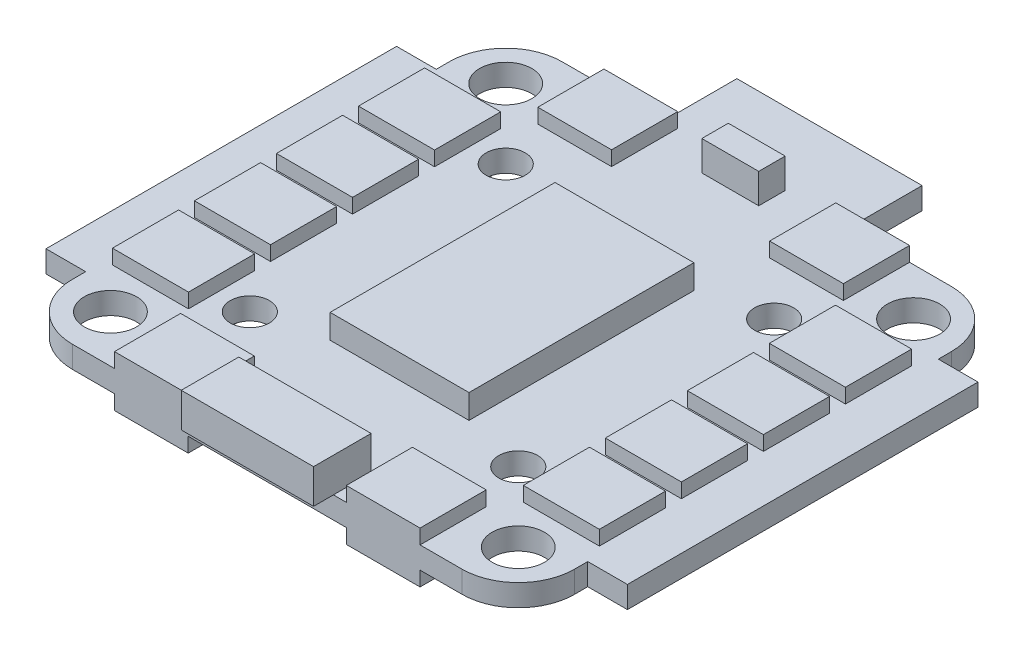
from build123d import *

# Parameters (mm, degrees)
SKETCH1_R                       = 1.975
PCB_DEPTH                       = 0.825
INNER_HOLES_DEPTH               = 48.873511726
INNER_HOLES_DEPTH_BACK          = 48.873511726
SKETCH7_R                       = 1.475
SKETCH8_W                       = 10
SKETCH8_H                       = 4.35
CONNECTOR_DEPTH                 = 2.6
SKETCH9_W                       = 4.3
SKETCH9_H                       = 2
TOP_COMPONENT_DEPTH             = 2.255
SKETCH10_W                      = 5.75
SKETCH10_H                      = 5
SIDE_COMPONENTS_DEPTH           = 1.1
SKETCH11_W                      = 10.5
SKETCH11_H                      = 17
CENTRAL_COMPONENTS_DEPTH        = 1.825
SKETCH12_W                      = 5.575
SKETCH12_H                      = 5
TOP_AND_BOTTOM_COMPONENTS_DEPTH = 1.105


with BuildPart() as part:
    # Sketch1 → PCB (new, symmetric)
    with BuildSketch(Plane(origin=(0, 0, 0), x_dir=(1, 0, 0), z_dir=(0, 1, 0))):
        with BuildLine():
            Line((-7, 42.5), (7, 42.5))
            Line((7, 42.5), (7, 37))
            Line((7, 37), (14.725, 37))
            ThreePointArc((14.725, 37), (17.73020382, 35.75520382), (18.975, 32.75))
            Line((18.975, 32.75), (18.975, 31.75))
            Line((18.975, 31.75), (21.975, 31.75))
            Line((21.975, 31.75), (21.975, 5.25))
            Line((21.975, 5.25), (18.975, 5.25))
            Line((18.975, 5.25), (18.975, 4.25))
            ThreePointArc((18.975, 4.25), (17.73020382, 1.24479618), (14.725, 0))
            Line((14.725, 0), (-14.725, 0))
            ThreePointArc((-14.725, 0), (-17.73020382, 1.24479618), (-18.975, 4.25))
            Line((-18.975, 4.25), (-18.975, 5.25))
            Line((-18.975, 5.25), (-21.975, 5.25))
            Line((-21.975, 5.25), (-21.975, 31.75))
            Line((-21.975, 31.75), (-18.975, 31.75))
            Line((-18.975, 31.75), (-18.975, 32.75))
            ThreePointArc((-18.975, 32.75), (-17.73020382, 35.75520382), (-14.725, 37))
            Line((-14.725, 37), (-7, 37))
            Line((-7, 37), (-7, 42.5))
        make_face()
        with Locations(Location((15.414429112, 33.439429112, 0), (0, 0, 270))):
            Circle(SKETCH1_R, mode=Mode.SUBTRACT)
        with Locations(Location((15.414429112, 3.560570888, 0), (0, 0, 90))):
            Circle(SKETCH1_R, mode=Mode.SUBTRACT)
        with Locations(Location((-15.414429112, 3.560570888, 0), (0, 0, 270))):
            Circle(SKETCH1_R, mode=Mode.SUBTRACT)
        with Locations(Location((-15.414429112, 33.439429112, 0), (0, 0, 90))):
            Circle(SKETCH1_R, mode=Mode.SUBTRACT)
    extrude(amount=PCB_DEPTH, both=True)

    # Sketch7 → inner holes (cut, two sides: drawn at the far end of the back side and taken through both)
    with BuildSketch(Plane(origin=(0, 0.825, 0), x_dir=(1, 0, 0), z_dir=(0, 1, 0)).offset(-INNER_HOLES_DEPTH_BACK)):
        with Locations(Location((10.146483592, 28.171483592, 0), (0, 0, 270))):
            Circle(SKETCH7_R)
        with Locations(Location((-10.146483592, 28.171483592, 0), (0, 0, 90))):
            Circle(SKETCH7_R)
        with Locations(Location((-10.146483592, 8.828516408, 0), (0, 0, 270))):
            Circle(SKETCH7_R)
        with Locations(Location((10.146483592, 8.828516408, 0), (0, 0, 90))):
            Circle(SKETCH7_R)
    extrude(amount=INNER_HOLES_DEPTH + INNER_HOLES_DEPTH_BACK, mode=Mode.SUBTRACT)

    # Sketch8 → Connector (add)
    with BuildSketch(Plane(origin=(0, 0.825, 0), x_dir=(1, 0, 0), z_dir=(0, 1, 0))):
        with Locations((0, 0.675)):
            Rectangle(SKETCH8_W, SKETCH8_H)
    extrude(amount=CONNECTOR_DEPTH)

    # Sketch9 → Top component (add)
    with BuildSketch(Plane(origin=(0, 0.825, 0), x_dir=(1, 0, 0), z_dir=(0, 1, 0))):
        with Locations((0, 36)):
            Rectangle(SKETCH9_W, SKETCH9_H)
    extrude(amount=TOP_COMPONENT_DEPTH)

    # Sketch10 → Side Components (add)
    with BuildSketch(Plane(origin=(0, 0.825, 0), x_dir=(1, 0, 0), z_dir=(0, 1, 0))):
        with Locations((15.53, 15.4)):
            Rectangle(SKETCH10_W, SKETCH10_H)
        with Locations((15.53, 9.2)):
            Rectangle(SKETCH10_W, SKETCH10_H)
        with Locations((15.53, 21.6)):
            Rectangle(SKETCH10_W, SKETCH10_H)
        with Locations((15.53, 27.8)):
            Rectangle(SKETCH10_W, SKETCH10_H)
        with Locations((-15.53, 9.2)):
            Rectangle(SKETCH10_W, SKETCH10_H)
        with Locations((-15.53, 15.4)):
            Rectangle(SKETCH10_W, SKETCH10_H)
        with Locations((-15.53, 21.6)):
            Rectangle(SKETCH10_W, SKETCH10_H)
        with Locations((-15.53, 27.8)):
            Rectangle(SKETCH10_W, SKETCH10_H)
    side_components = extrude(amount=SIDE_COMPONENTS_DEPTH)

    # Sketch11 → Central components (add)
    with BuildSketch(Plane(origin=(0, 0.825, 0), x_dir=(1, 0, 0), z_dir=(0, 1, 0))):
        with Locations((0, 18.5)):
            Rectangle(SKETCH11_W, SKETCH11_H)
    extrude(amount=CENTRAL_COMPONENTS_DEPTH)

    # Sketch12 → Top and bottom components (add)
    with BuildSketch(Plane(origin=(0, 0.825, 0), x_dir=(1, 0, 0), z_dir=(0, 1, 0))):
        with Locations((8.7625, 34.5)):
            Rectangle(SKETCH12_W, SKETCH12_H)
        with Locations((8.7625, 2.5)):
            Rectangle(SKETCH12_W, SKETCH12_H)
        with Locations((-8.7625, 2.5)):
            Rectangle(SKETCH12_W, SKETCH12_H)
        with Locations((-8.7625, 34.5)):
            Rectangle(SKETCH12_W, SKETCH12_H)
    top_and_bottom_components = extrude(amount=TOP_AND_BOTTOM_COMPONENTS_DEPTH)

    # Mirror2: Side Components, Top and bottom components across plane
    add(side_components.mirror(Plane.ZX))
    add(top_and_bottom_components.mirror(Plane.ZX))


solid = part.part
